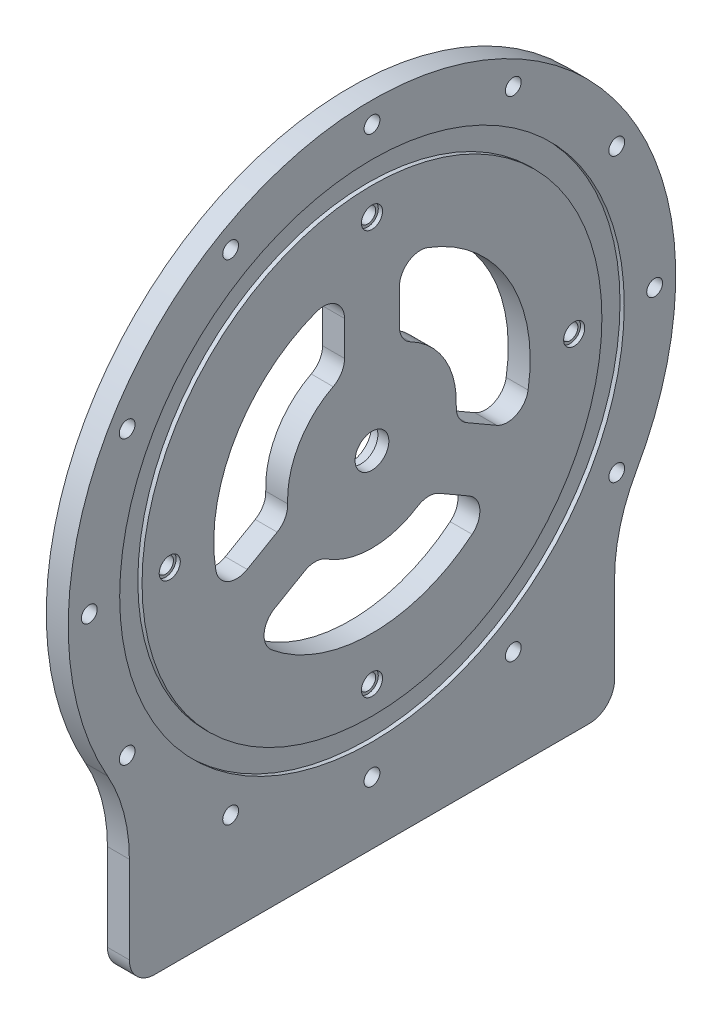
from build123d import *

# Parameters (mm, degrees)
SKETCH1_R           = 5.08
BOSS_EXTRUDE1_DEPTH = 6.604
SKETCH2_R           = 6.477
CUT_EXTRUDE1_DEPTH  = 3.302
SKETCH3_R           = 75.946
SKETCH3_R_2         = 69.215
CUT_EXTRUDE2_DEPTH  = 1.27
SKETCH4_R           = 2.38125
CUT_EXTRUDE3_DEPTH  = 139.530727768
SKETCH5_R           = 3.77825
CUT_EXTRUDE4_DEPTH  = 1.27
CUT_EXTRUDE5_DEPTH  = 139.530727768
SKETCH10_R          = 57.15
SKETCH10_R_2        = 50.8
CUT_EXTRUDE6_DEPTH  = 1.27
SKETCH12_R          = 2.38125
CUT_EXTRUDE7_DEPTH  = 139.530727768
SKETCH15_R          = 3.175
CUT_EXTRUDE11_DEPTH = 1.27


with BuildPart() as part:
    # Sketch1 → Boss-Extrude1 (new body)
    with BuildSketch(Plane(origin=(0, 0, 0), x_dir=(0, 0, -1), z_dir=(1, 0, 0))):
        with BuildLine():
            Line((-65.405, -103.855072673), (65.405, -103.855072673))
            ThreePointArc((65.405, -103.855072673), (70.793153673, -101.623226346), (73.025, -96.235072673))
            Line((73.025, -96.235072673), (73.025, -69.997049759))
            ThreePointArc((73.025, -69.997049759), (74.696702219, -57.072253546), (79.601785714, -44.998103417))
            ThreePointArc((79.601785714, -44.998103417), (0, 91.44), (-79.601785714, -44.998103417))
            ThreePointArc((-79.601785714, -44.998103417), (-74.696702219, -57.072253546), (-73.025, -69.997049759))
            Line((-73.025, -69.997049759), (-73.025, -96.235072673))
            ThreePointArc((-73.025, -96.235072673), (-70.793153673, -101.623226346), (-65.405, -103.855072673))
        make_face()
        with Locations(Location((0, 0, 0), (0, 0, 180))):
            Circle(SKETCH1_R, mode=Mode.SUBTRACT)
    extrude(amount=BOSS_EXTRUDE1_DEPTH)

    # Sketch2 → Cut-Extrude1 (cut)
    with BuildSketch(Plane(origin=(0, 0, 0), x_dir=(0, 0, -1), z_dir=(1, 0, 0))):
        with Locations(Location((0, 0, 0), (0, 0, 180))):
            Circle(SKETCH2_R)
    extrude(amount=CUT_EXTRUDE1_DEPTH, mode=Mode.SUBTRACT)

    # Sketch3 → Cut-Extrude2 (cut)
    with BuildSketch(Plane(origin=(6.604, 0, 0), x_dir=(0, 0, -1), z_dir=(1, 0, 0))):
        Circle(SKETCH3_R)
        Circle(SKETCH3_R_2, mode=Mode.SUBTRACT)
    extrude(amount=-CUT_EXTRUDE2_DEPTH, mode=Mode.SUBTRACT)

    # Sketch4 → Cut-Extrude3 (cut, through all)
    with BuildSketch(Plane.ZY):
        with Locations((0, 85.09)):
            Circle(SKETCH4_R)
        with Locations((42.545, 73.690101608)):
            Circle(SKETCH4_R)
        with Locations((73.690101608, 42.545)):
            Circle(SKETCH4_R)
        with Locations((85.09, 0)):
            Circle(SKETCH4_R)
        with Locations((73.690101608, -42.545)):
            Circle(SKETCH4_R)
        with Locations((42.545, -73.690101608)):
            Circle(SKETCH4_R)
        with Locations((0, -85.09)):
            Circle(SKETCH4_R)
        with Locations((-42.545, -73.690101608)):
            Circle(SKETCH4_R)
        with Locations((-73.690101608, -42.545)):
            Circle(SKETCH4_R)
        with Locations((-85.09, 0)):
            Circle(SKETCH4_R)
        with Locations((-73.690101608, 42.545)):
            Circle(SKETCH4_R)
        with Locations((-42.545, 73.690101608)):
            Circle(SKETCH4_R)
    extrude(amount=-CUT_EXTRUDE3_DEPTH, mode=Mode.SUBTRACT)

    # Sketch5 → Cut-Extrude4 (cut)
    with BuildSketch(Plane.ZY):
        with Locations((0, 85.09)):
            Circle(SKETCH5_R)
        with Locations((42.545, 73.690101608)):
            Circle(SKETCH5_R)
        with Locations((-42.545, 73.690101608)):
            Circle(SKETCH5_R)
        with Locations((73.690101608, 42.545)):
            Circle(SKETCH5_R)
        with Locations((85.09, 0)):
            Circle(SKETCH5_R)
        with Locations((73.690101608, -42.545)):
            Circle(SKETCH5_R)
        with Locations((42.545, -73.690101608)):
            Circle(SKETCH5_R)
        with Locations((0, -85.09)):
            Circle(SKETCH5_R)
        with Locations((-42.545, -73.690101608)):
            Circle(SKETCH5_R)
        with Locations((-73.690101608, -42.545)):
            Circle(SKETCH5_R)
        with Locations((-85.09, 0)):
            Circle(SKETCH5_R)
        with Locations((-73.690101608, 42.545)):
            Circle(SKETCH5_R)
    extrude(amount=-CUT_EXTRUDE4_DEPTH, mode=Mode.SUBTRACT)

    # Sketch9 → Cut-Extrude5 (cut, through all)
    with BuildSketch(Plane.ZY):
        with BuildLine():
            Line((-8.255, 38.60465775), (-8.255, 28.191425558))
            ThreePointArc((-8.255, 28.191425558), (-9.179557622, 24.89186877), (-11.684, 22.553140447))
            ThreePointArc((-11.684, 22.553140447), (-21.997045256, 12.7), (-25.373592562, -1.157929405))
            ThreePointArc((-25.373592562, -1.157929405), (-26.146769513, -4.496204289), (-28.541990702, -6.946673071))
            Line((-28.541990702, -6.946673071), (-37.560114316, -12.153289167))
            ThreePointArc((-37.560114316, -12.153289167), (-43.454984563, -12.392041955), (-47.00205498, -7.677724445))
            ThreePointArc((-47.00205498, -7.677724445), (-41.244459855, 23.8125), (-16.851923077, 44.543835865))
            ThreePointArc((-16.851923077, 44.543835865), (-10.995669144, 43.82914153), (-8.255, 38.60465775))
        make_face()
        with BuildLine():
            Line((8.255, 38.60465775), (8.255, 28.191425558))
            ThreePointArc((8.255, 28.191425558), (9.179557622, 24.89186877), (11.684, 22.553140447))
            ThreePointArc((11.684, 22.553140447), (21.997045256, 12.7), (25.373592562, -1.157929405))
            ThreePointArc((25.373592562, -1.157929405), (26.146769513, -4.496204289), (28.541990702, -6.946673071))
            Line((28.541990702, -6.946673071), (37.560114316, -12.153289167))
            ThreePointArc((37.560114316, -12.153289167), (43.454984563, -12.392041955), (47.00205498, -7.677724445))
            ThreePointArc((47.00205498, -7.677724445), (41.244459855, 23.8125), (16.851923077, 44.543835865))
            ThreePointArc((16.851923077, 44.543835865), (10.995669144, 43.82914153), (8.255, 38.60465775))
        make_face()
        with BuildLine():
            Line((29.305114316, -26.451368583), (20.286990702, -21.244752487))
            ThreePointArc((20.286990702, -21.244752487), (16.967211891, -20.395664481), (13.689592562, -21.395211041))
            ThreePointArc((13.689592562, -21.395211041), (0, -25.4), (-13.689592562, -21.395211041))
            ThreePointArc((-13.689592562, -21.395211041), (-16.967211891, -20.395664481), (-20.286990702, -21.244752487))
            Line((-20.286990702, -21.244752487), (-29.305114316, -26.451368583))
            ThreePointArc((-29.305114316, -26.451368583), (-32.459315419, -31.437099575), (-30.150131903, -36.86611142))
            ThreePointArc((-30.150131903, -36.86611142), (0, -47.625), (30.150131903, -36.86611142))
            ThreePointArc((30.150131903, -36.86611142), (32.459315419, -31.437099575), (29.305114316, -26.451368583))
        make_face()
    extrude(amount=-CUT_EXTRUDE5_DEPTH, mode=Mode.SUBTRACT)

    # Sketch10 → Cut-Extrude6 (cut)
    with BuildSketch(Plane.ZY):
        Circle(SKETCH10_R)
        Circle(SKETCH10_R_2, mode=Mode.SUBTRACT)
    extrude(amount=-CUT_EXTRUDE6_DEPTH, mode=Mode.SUBTRACT)

    # Sketch12 → Cut-Extrude7 (cut, through all)
    with BuildSketch(Plane.ZY):
        with Locations((0, 60.874333344)):
            Circle(SKETCH12_R)
        with Locations((60.874333344, 0)):
            Circle(SKETCH12_R)
        with Locations((0, -60.874333344)):
            Circle(SKETCH12_R)
        with Locations((-60.874333344, 0)):
            Circle(SKETCH12_R)
    extrude(amount=-CUT_EXTRUDE7_DEPTH, mode=Mode.SUBTRACT)

    # Sketch15 → Cut-Extrude11 (cut)
    with BuildSketch(Plane(origin=(6.604, 0, 0), x_dir=(0, 0, -1), z_dir=(1, 0, 0))):
        with Locations((0, 60.874333344)):
            Circle(SKETCH15_R)
        with Locations((60.874333344, 0)):
            Circle(SKETCH15_R)
        with Locations((0, -60.874333344)):
            Circle(SKETCH15_R)
        with Locations((-60.874333344, 0)):
            Circle(SKETCH15_R)
    extrude(amount=-CUT_EXTRUDE11_DEPTH, mode=Mode.SUBTRACT)


solid = part.part
